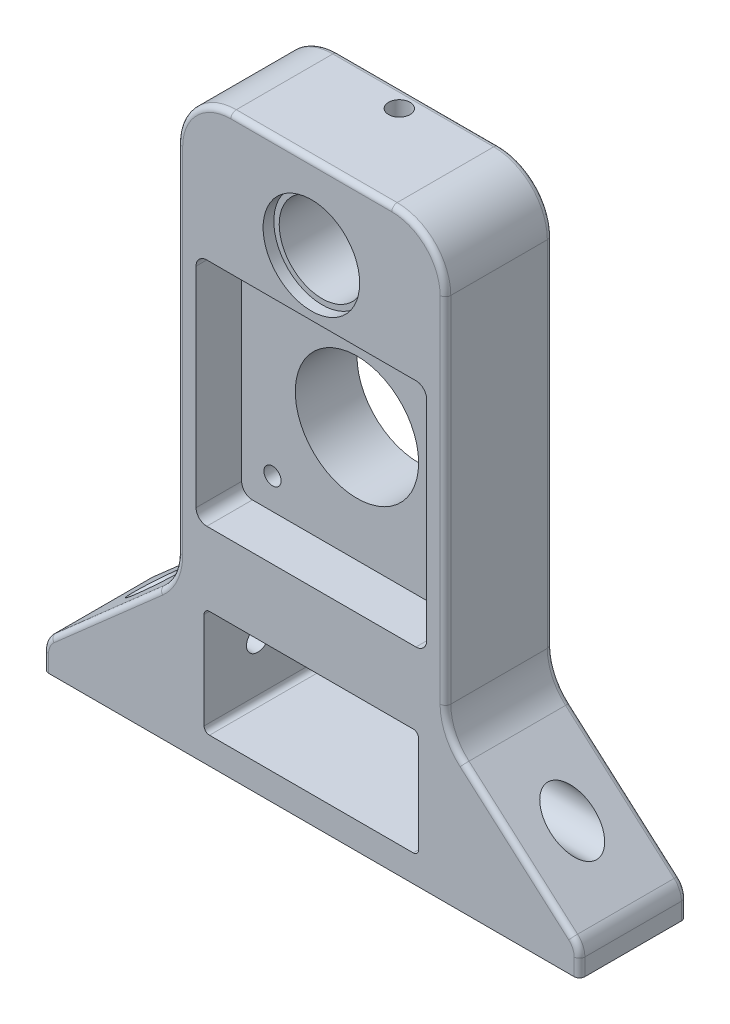
from build123d import *

# Parameters (mm, degrees)
BOSS_EXTRUDE1_DEPTH             = 20
CUT_EXTRUDE3_DEPTH              = 8.5
CUT_EXTRUDE4_REACH              = 107.794
SKETCH5_R                       = 11.5
SKETCH5_R_2                     = 1.6
CUT_EXTRUDE5_REACH              = 109.052
SKETCH6_R                       = 8
SKETCH7_R                       = 3
CUT_EXTRUDE6_DEPTH              = 4
SKETCH8_R                       = 9
CUT_EXTRUDE7_DEPTH              = 6
CUT_EXTRUDE8_START              = -2
SKETCH9_R                       = 9
CUT_EXTRUDE8_DEPTH              = 2
CUT_EXTRUDE9_REACH              = 122.253
CUT_EXTRUDE9_END_RADIUS         = 9
SKETCH10_R                      = 2
FILLET1_R                       = 1
CUT_EXTRUDE10_REACH             = 119.729
SKETCH11_R                      = 2.1
CUT_EXTRUDE10_DIRECTION_2_REACH = 119.729
CUT_EXTRUDE11_REACH             = 127.729
CUT_EXTRUDE11_START             = -8
SKETCH12_R                      = 4
CUT_EXTRUDE12_REACH             = 127.729
CUT_EXTRUDE12_START             = -8
SKETCH13_R                      = 4


with BuildPart() as part:
    # Sketch1 → Boss-Extrude1 (new body)
    with BuildSketch(Plane.XY):
        with BuildLine():
            Line((-50, -15), (50, -15))
            Line((50, -15), (50, -11.808264258))
            ThreePointArc((50, -11.808264258), (49.644862571, -10.16054558), (48.64251158, -8.80541019))
            Line((48.64251158, -8.80541019), (28.393721051, 9.013525475))
            ThreePointArc((28.393721051, 9.013525475), (25.887843573, 12.40136395), (25, 16.520660644))
            Line((25, 16.520660644), (25, 82.520660644))
            ThreePointArc((25, 82.520660644), (22.071067812, 89.591728456), (15, 92.520660644))
            Line((15, 92.520660644), (-15, 92.520660644))
            ThreePointArc((-15, 92.520660644), (-22.071067812, 89.591728456), (-25, 82.520660644))
            Line((-25, 82.520660644), (-25, 16.520660644))
            ThreePointArc((-25, 16.520660644), (-25.887843573, 12.40136395), (-28.393721051, 9.013525475))
            Line((-28.393721051, 9.013525475), (-48.64251158, -8.80541019))
            ThreePointArc((-48.64251158, -8.80541019), (-49.644862571, -10.16054558), (-50, -11.808264258))
            Line((-50, -11.808264258), (-50, -15))
        make_face()
        with BuildLine():
            Line((-19, 10), (19, 10))
            ThreePointArc((19, 10), (19.707106781, 9.707106781), (20, 9))
            Line((20, 9), (20, -9))
            ThreePointArc((20, -9), (19.707106781, -9.707106781), (19, -10))
            Line((19, -10), (-19, -10))
            ThreePointArc((-19, -10), (-19.707106781, -9.707106781), (-20, -9))
            Line((-20, -9), (-20, 9))
            ThreePointArc((-20, 9), (-19.707106781, 9.707106781), (-19, 10))
        make_face(mode=Mode.SUBTRACT)
    extrude(amount=BOSS_EXTRUDE1_DEPTH)

    # Sketch4 → Cut-Extrude3 (cut)
    with BuildSketch(Plane.XY.offset(20)):
        with BuildLine():
            Line((-19.5, 66.5), (19.5, 66.5))
            ThreePointArc((19.5, 66.5), (20.914213562, 65.914213562), (21.5, 64.5))
            Line((21.5, 64.5), (21.5, 25.5))
            ThreePointArc((21.5, 25.5), (20.914213562, 24.085786438), (19.5, 23.5))
            Line((19.5, 23.5), (-19.5, 23.5))
            ThreePointArc((-19.5, 23.5), (-20.914213562, 24.085786438), (-21.5, 25.5))
            Line((-21.5, 25.5), (-21.5, 64.5))
            ThreePointArc((-21.5, 64.5), (-20.914213562, 65.914213562), (-19.5, 66.5))
        make_face()
    extrude(amount=-CUT_EXTRUDE3_DEPTH, mode=Mode.SUBTRACT)

    # Sketch5 → Cut-Extrude4 (cut, up to next)
    with BuildSketch(Plane.XY.offset(11.5), mode=Mode.PRIVATE) as cut_extrude4_sk1:
        with Locations((0, 45)):
            Circle(SKETCH5_R)
    cut_extrude4_tool1 = extrude(cut_extrude4_sk1.sketch, amount=-CUT_EXTRUDE4_REACH, mode=Mode.PRIVATE) & part.part
    # Sketch5 → Cut-Extrude4 (cut, up to next)
    with BuildSketch(Plane.XY.offset(11.5), mode=Mode.PRIVATE) as cut_extrude4_sk2:
        with Locations((-15.75, 60.75)):
            Circle(SKETCH5_R_2)
    cut_extrude4_tool2 = extrude(cut_extrude4_sk2.sketch, amount=-CUT_EXTRUDE4_REACH, mode=Mode.PRIVATE) & part.part
    # Sketch5 → Cut-Extrude4 (cut, up to next)
    with BuildSketch(Plane.XY.offset(11.5), mode=Mode.PRIVATE) as cut_extrude4_sk3:
        with Locations((15.75, 60.75)):
            Circle(SKETCH5_R_2)
    cut_extrude4_tool3 = extrude(cut_extrude4_sk3.sketch, amount=-CUT_EXTRUDE4_REACH, mode=Mode.PRIVATE) & part.part
    # Sketch5 → Cut-Extrude4 (cut, up to next)
    with BuildSketch(Plane.XY.offset(11.5), mode=Mode.PRIVATE) as cut_extrude4_sk4:
        with Locations((-15.75, 29.25)):
            Circle(SKETCH5_R_2)
    cut_extrude4_tool4 = extrude(cut_extrude4_sk4.sketch, amount=-CUT_EXTRUDE4_REACH, mode=Mode.PRIVATE) & part.part
    # Sketch5 → Cut-Extrude4 (cut, up to next)
    with BuildSketch(Plane.XY.offset(11.5), mode=Mode.PRIVATE) as cut_extrude4_sk5:
        with Locations((15.75, 29.25)):
            Circle(SKETCH5_R_2)
    cut_extrude4_tool5 = extrude(cut_extrude4_sk5.sketch, amount=-CUT_EXTRUDE4_REACH, mode=Mode.PRIVATE) & part.part
    add(cut_extrude4_tool1.solids().sort_by_distance((0, 45, 11.5))[0], mode=Mode.SUBTRACT)
    add(cut_extrude4_tool2.solids().sort_by_distance((-15.75, 60.75, 11.5))[0], mode=Mode.SUBTRACT)
    add(cut_extrude4_tool3.solids().sort_by_distance((15.75, 60.75, 11.5))[0], mode=Mode.SUBTRACT)
    add(cut_extrude4_tool4.solids().sort_by_distance((-15.75, 29.25, 11.5))[0], mode=Mode.SUBTRACT)
    add(cut_extrude4_tool5.solids().sort_by_distance((15.75, 29.25, 11.5))[0], mode=Mode.SUBTRACT)

    # Sketch6 → Cut-Extrude5 (cut, up to next)
    with BuildSketch(Plane(origin=(0, 0, 0), x_dir=(-1, 0, 0), z_dir=(0, 0, -1)), mode=Mode.PRIVATE) as cut_extrude5_sk1:
        with Locations((0, 77)):
            Circle(SKETCH6_R)
    cut_extrude5_tool1 = extrude(cut_extrude5_sk1.sketch, amount=-CUT_EXTRUDE5_REACH, mode=Mode.PRIVATE) & part.part
    add(cut_extrude5_tool1.solids().sort_by_distance((0, 77, 0))[0], mode=Mode.SUBTRACT)

    # Sketch7 → Cut-Extrude6 (cut)
    with BuildSketch(Plane(origin=(0, 0, 0), x_dir=(-1, 0, 0), z_dir=(0, 0, -1))):
        with Locations((-15.75, 60.75)):
            Circle(SKETCH7_R)
        with Locations((15.75, 60.75)):
            Circle(SKETCH7_R)
        with Locations((15.75, 29.25)):
            Circle(SKETCH7_R)
        with Locations((-15.75, 29.25)):
            Circle(SKETCH7_R)
    extrude(amount=-CUT_EXTRUDE6_DEPTH, mode=Mode.SUBTRACT)

    # Sketch8 → Cut-Extrude7 (cut)
    with BuildSketch(Plane(origin=(0, 0, 0), x_dir=(-1, 0, 0), z_dir=(0, 0, -1))):
        with Locations((0, 77)):
            Circle(SKETCH8_R)
    extrude(amount=-CUT_EXTRUDE7_DEPTH, mode=Mode.SUBTRACT)

    # Sketch9 → Cut-Extrude8 (cut)
    with BuildSketch(Plane.XY.offset(20).offset(CUT_EXTRUDE8_START)):
        with Locations(Location((0, 77, 0), (0, 0, 180))):
            Circle(SKETCH9_R)
    extrude(amount=CUT_EXTRUDE8_DEPTH, mode=Mode.SUBTRACT)

    # Cut-Extrude9: up to this cylinder (the profile starts outside it)
    cut_extrude9_end = Plane(origin=(0, 77, 3.6), z_dir=(0, 0, -1)) * Cylinder(CUT_EXTRUDE9_END_RADIUS, 263.506, mode=Mode.PRIVATE)
    # Sketch10 → Cut-Extrude9 (cut, up to the surface)
    with BuildSketch(Plane(origin=(0, 92.520660644, 0), x_dir=(1, 0, 0), z_dir=(0, 1, 0)), mode=Mode.PRIVATE) as cut_extrude9_sk1:
        with Locations(Location((0, -3.6, 0), (0, 0, 270))):
            Circle(SKETCH10_R)
    cut_extrude9_tool1 = extrude(cut_extrude9_sk1.sketch, amount=-CUT_EXTRUDE9_REACH, mode=Mode.PRIVATE) - cut_extrude9_end
    add(cut_extrude9_tool1.solids().sort_by_distance((0, 92.520661, 3.6))[0], mode=Mode.SUBTRACT)

    # Fillet1
    fillet1_edges = [part.edges().sort_by_distance(p)[0] for p in [
        (50, -13.404132129, 20),
        (-49.644862571, -10.16054558, 0),
        (-38.518116315, 0.104057643, 0),
        (49.644862571, -10.16054558, 20),
        (-25.887843573, 12.40136395, 0),
        (-25, 49.520660644, 0),
        (-22.071067812, 89.591728456, 0),
        (0, 92.520660644, 0),
        (22.071067812, 89.591728456, 0),
        (25, 49.520660644, 0),
        (25.887843573, 12.40136395, 0),
        (38.518116315, 0.104057643, 20),
        (38.518116315, 0.104057643, 0),
        (49.644862571, -10.16054558, 0),
        (50, -13.404132129, 0),
        (-50, -13.404132129, 0),
        (25.887843573, 12.40136395, 20),
        (25, 49.520660644, 20),
        (22.071067812, 89.591728456, 20),
        (0, 92.520660644, 20),
        (-22.071067812, 89.591728456, 20),
        (-25, 49.520660644, 20),
        (-25.887843573, 12.40136395, 20),
        (-50, -13.404132129, 20),
        (-38.518116315, 0.104057643, 20),
        (-49.644862571, -10.16054558, 20),
    ]]
    fillet(fillet1_edges, radius=FILLET1_R)

    # Sketch11 → Cut-Extrude10 (cut, up to next)
    with BuildSketch(Plane(origin=(-20, 0, 0), x_dir=(0, 0, -1), z_dir=(1, 0, 0)), mode=Mode.PRIVATE) as cut_extrude10_sk1:
        with Locations(Location((-10, 0, 0), (0, 0, 270))):
            Circle(SKETCH11_R)
    cut_extrude10_tool1 = extrude(cut_extrude10_sk1.sketch, amount=-CUT_EXTRUDE10_REACH, mode=Mode.PRIVATE) & part.part
    add(cut_extrude10_tool1.solids().sort_by_distance((-20, 0, 10))[0], mode=Mode.SUBTRACT)

    # Sketch11 → Cut-Extrude10 direction 2 (cut, up to next)
    with BuildSketch(Plane(origin=(-20, 0, 0), x_dir=(0, 0, -1), z_dir=(1, 0, 0)), mode=Mode.PRIVATE) as cut_extrude10_direction_2_sk1:
        with Locations(Location((-10, 0, 0), (0, 0, 270))):
            Circle(SKETCH11_R)
    cut_extrude10_direction_2_tool1 = extrude(cut_extrude10_direction_2_sk1.sketch, amount=CUT_EXTRUDE10_DIRECTION_2_REACH, mode=Mode.PRIVATE) & part.part
    add(cut_extrude10_direction_2_tool1.solids().sort_by_distance((-20, 0, 10))[0], mode=Mode.SUBTRACT)

    # Cut-Extrude11: up to this plane
    cut_extrude11_end = Plane(origin=(-48.64251158, -8.80541019, 20), z_dir=(0.6606278948920247, -0.7507135169227553, 0))
    # Sketch12 → Cut-Extrude11 (cut, up to the surface)
    with BuildSketch(Plane(origin=(-20, 0, 0), x_dir=(0, 0, -1), z_dir=(1, 0, 0)).offset(CUT_EXTRUDE11_START), mode=Mode.PRIVATE) as cut_extrude11_sk1:
        with Locations((-10, 0)):
            Circle(SKETCH12_R)
    cut_extrude11_tool1 = split(extrude(cut_extrude11_sk1.sketch, amount=-CUT_EXTRUDE11_REACH, mode=Mode.PRIVATE), bisect_by=cut_extrude11_end, keep=Keep.BOTH, mode=Mode.PRIVATE)
    add(cut_extrude11_tool1.solids().sort_by_distance((-28, 0, 10))[0], mode=Mode.SUBTRACT)

    # Cut-Extrude12: up to this plane
    cut_extrude12_end = Plane(origin=(48.64251158, -8.80541019, 20), z_dir=(-0.660627894892025, -0.750713516922755, 0))
    # Sketch13 → Cut-Extrude12 (cut, up to the surface)
    with BuildSketch(Plane.ZY.offset(-20).offset(CUT_EXTRUDE12_START), mode=Mode.PRIVATE) as cut_extrude12_sk1:
        with Locations(Location((10, 0, 0), (0, 0, 180))):
            Circle(SKETCH13_R)
    cut_extrude12_tool1 = split(extrude(cut_extrude12_sk1.sketch, amount=-CUT_EXTRUDE12_REACH, mode=Mode.PRIVATE), bisect_by=cut_extrude12_end, keep=Keep.BOTH, mode=Mode.PRIVATE)
    add(cut_extrude12_tool1.solids().sort_by_distance((28, 0, 10))[0], mode=Mode.SUBTRACT)


solid = part.part
